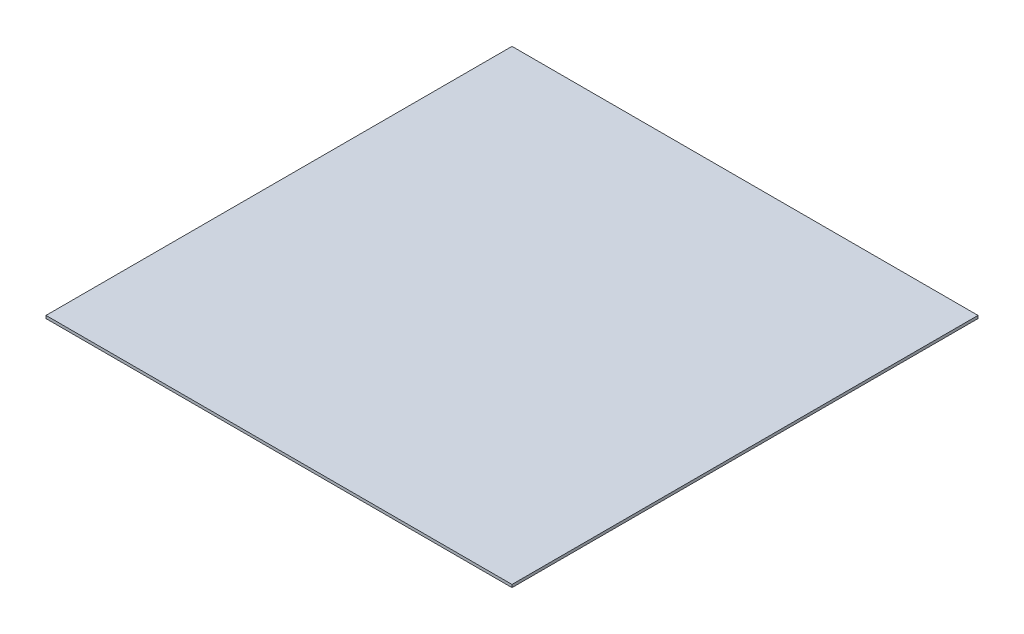
from build123d import *

# Parameters (mm, degrees)
SKETCH1_W           = 25
SKETCH1_H           = 25
BOSS_EXTRUDE1_DEPTH = 0.15


with BuildPart() as part:
    # Sketch1 → Boss-Extrude1 (new body)
    with BuildSketch(Plane(origin=(0, 0, 0), x_dir=(1, 0, 0), z_dir=(0, 1, 0))):
        Rectangle(SKETCH1_W, SKETCH1_H)
    extrude(amount=BOSS_EXTRUDE1_DEPTH)


solid = part.part
